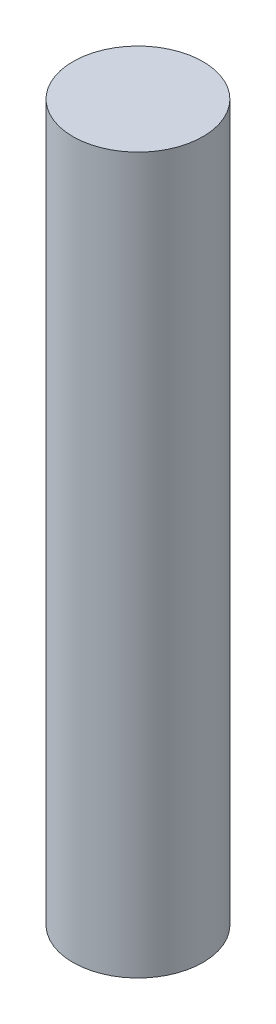
from build123d import *

# Parameters (mm, degrees)
SKETCH1_R           = 1.524
BOSS_EXTRUDE1_DEPTH = 16.764


with BuildPart() as part:
    # Sketch1 → Boss-Extrude1 (new body)
    with BuildSketch(Plane(origin=(0, 0, 0), x_dir=(1, 0, 0), z_dir=(0, 1, 0))):
        with Locations(Location((0, 0, 0), (0, 0, 270))):
            Circle(SKETCH1_R)
    extrude(amount=BOSS_EXTRUDE1_DEPTH)


solid = part.part
